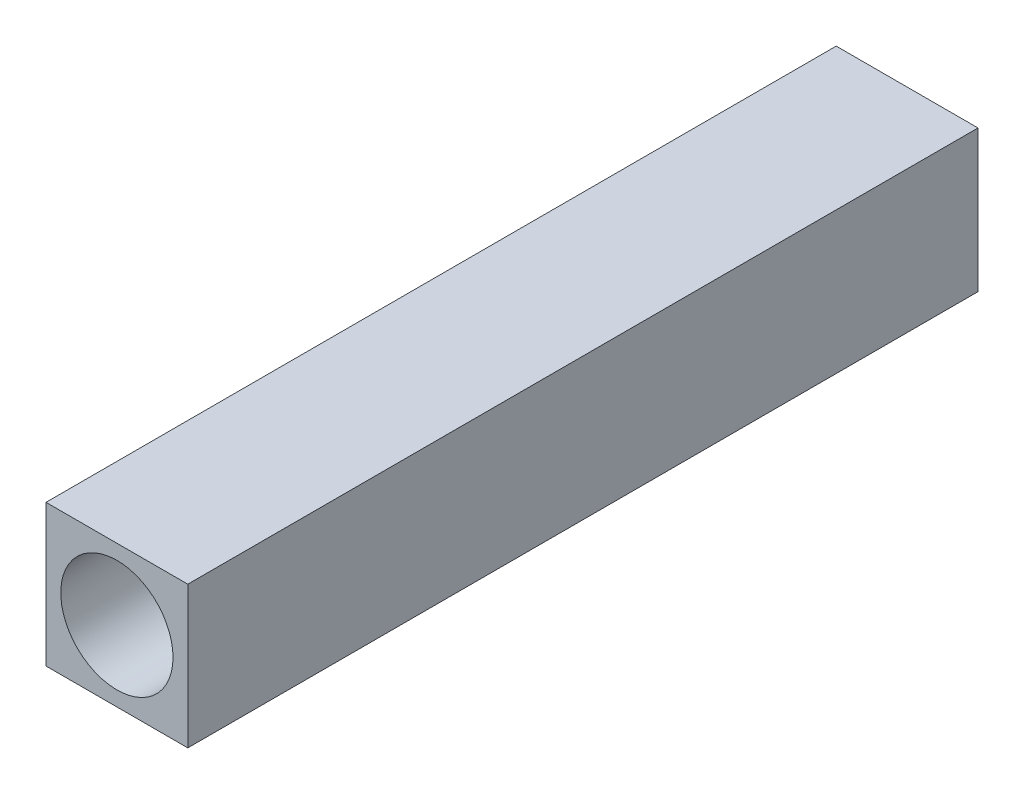
from build123d import *

# Parameters (mm, degrees)
SKETCH1_R               = 12.192
SKETCH1_R_2             = 9.652
MAIN_INNER_TUBE_DEPTH   = 135.89
SKETCH2_W               = 24.384
SKETCH2_H               = 24.384
SKETCH2_R               = 9.652
RECTANGLE_OUTSIDE_DEPTH = 135.89


with BuildPart() as part:
    # Sketch1 → Main Inner Tube (new body)
    with BuildSketch(Plane.XY):
        Circle(SKETCH1_R)
        Circle(SKETCH1_R_2, mode=Mode.SUBTRACT)
    extrude(amount=MAIN_INNER_TUBE_DEPTH)

    # Sketch2 → Rectangle Outside (add, through all)
    with BuildSketch(Plane(origin=(0, 0, 0), x_dir=(-1, 0, 0), z_dir=(0, 0, -1))):
        Rectangle(SKETCH2_W, SKETCH2_H)
        with Locations(Location((0, 0, 0), (0, 0, 180))):
            Circle(SKETCH2_R, mode=Mode.SUBTRACT)
    extrude(amount=-RECTANGLE_OUTSIDE_DEPTH)


solid = part.part
